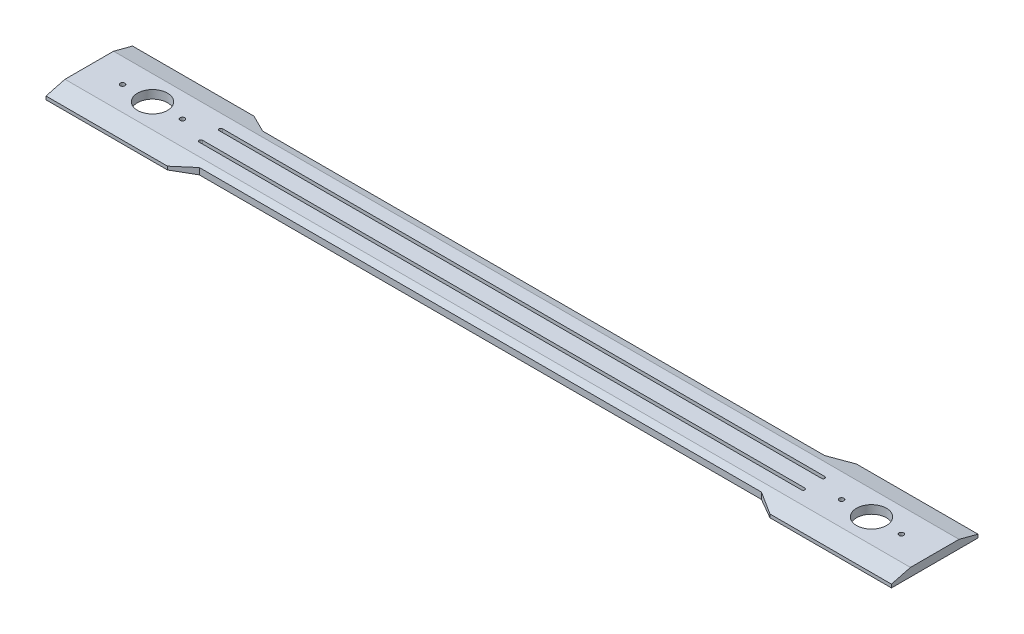
from build123d import *

# Parameters (mm, degrees)
EXTRUDE_1_DEPTH     = 25
SKETCH_2_R          = 45
SKETCH_2_R_2        = 7
CUT_EXTRUDE_1_DEPTH = 1277.880965478
CUT_EXTRUDE_2_DEPTH = 1277.880965478
CUT_EXTRUDE_3_DEPTH = 2544.447463582


with BuildPart() as part:
    # 草图1 → 凸台-拉伸1 (new body)
    with BuildSketch(Plane(origin=(0, 0, 0), x_dir=(1, 0, 0), z_dir=(0, 1, 0))):
        Polygon((-1270, 130), (-1270, -130), (-905, -130), (-844.378221735, -95), (844.378221735, -95), (905, -130), (1270, -130), (1270, 130), (905, 130), (844.378221735, 95), (-844.378221735, 95), (-905, 130), align=None)
    extrude(amount=EXTRUDE_1_DEPTH)

    # 草图2 → 切除-拉伸1 (cut, through all)
    with BuildSketch(Plane(origin=(0, 25, 0), x_dir=(1, 0, 0), z_dir=(0, 1, 0))):
        with Locations(Location((-1080, 0, 0), (0, 0, 270))):
            Circle(SKETCH_2_R)
        with Locations(Location((-1170, 0, 0), (0, 0, 270))):
            Circle(SKETCH_2_R_2)
        with Locations(Location((-990, 0, 0), (0, 0, 270))):
            Circle(SKETCH_2_R_2)
    cut_extrude_1 = extrude(amount=-CUT_EXTRUDE_1_DEPTH, mode=Mode.SUBTRACT)

    # 镜向1: 切除-拉伸1 across plane
    add(cut_extrude_1.mirror(Plane(origin=(0, 0, 0), x_dir=(0, 0, 1), z_dir=(1, 0, 0))), mode=Mode.SUBTRACT)

    # 草图3 → 切除-拉伸2 (cut, through all)
    with BuildSketch(Plane(origin=(0, 25, 0), x_dir=(1, 0, 0), z_dir=(0, 1, 0))):
        with BuildLine():
            Line((-905, -35), (905, -35))
            ThreePointArc((905, -35), (910, -30), (905, -25))
            Line((905, -25), (-905, -25))
            ThreePointArc((-905, -25), (-910, -30), (-905, -35))
        make_face()
    cut_extrude_2 = extrude(amount=-CUT_EXTRUDE_2_DEPTH, mode=Mode.SUBTRACT)

    # 镜向2: 切除-拉伸2 across plane
    add(cut_extrude_2.mirror(Plane.XY), mode=Mode.SUBTRACT)

    # 草图6 → 切除-拉伸3 (cut, through all)
    with BuildSketch(Plane(origin=(1270, 0, 0), x_dir=(0, 0, -1), z_dir=(1, 0, 0))):
        Polygon((-73, 25), (-130, 10), (-130, 25), align=None)
        Polygon((73, 25), (130, 10), (130, 25), align=None)
    extrude(amount=-CUT_EXTRUDE_3_DEPTH, mode=Mode.SUBTRACT)


solid = part.part
